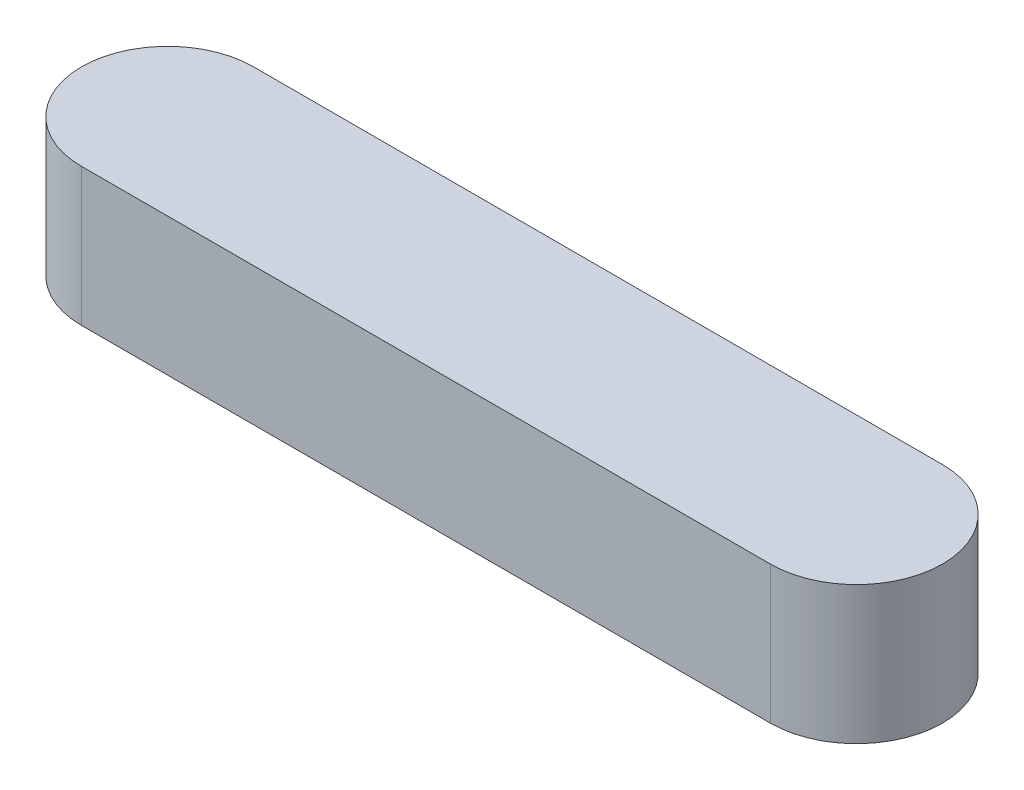
from build123d import *

# Parameters (mm, degrees)
BOSS_EXTRUDE1_DEPTH = 8


with BuildPart() as part:
    # Sketch1 → Boss-Extrude1 (new body)
    with BuildSketch(Plane(origin=(0, 0, 0), x_dir=(1, 0, 0), z_dir=(0, 1, 0))):
        with BuildLine():
            Line((-20, 5), (20, 5))
            ThreePointArc((20, 5), (25, 0), (20, -5))
            Line((20, -5), (-20, -5))
            ThreePointArc((-20, -5), (-25, 0), (-20, 5))
        make_face()
    extrude(amount=BOSS_EXTRUDE1_DEPTH)


solid = part.part
